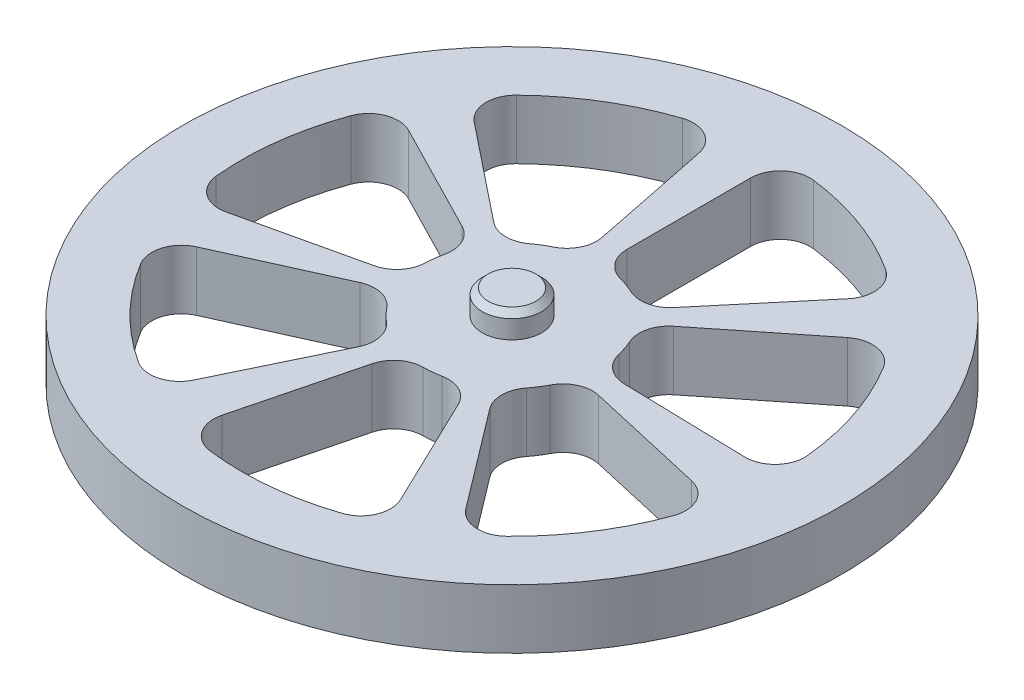
from build123d import *

# Parameters (mm, degrees)
SKETCH1_R                = 55.5
BOSS_EXTRUDE1_DEPTH      = 10
CUT_EXTRUDE1_DEPTH       = 80.123321467
FILLET1_R                = 5
CIRPATTERN1_COUNT        = 7
FILLET1_OF_CIRPATTERN1_R = 5
SKETCH3_R                = 5
BOSS_EXTRUDE2_DEPTH      = 4.1
CHAMFER1_SIZE            = 1


with BuildPart() as part:
    # Sketch1 → Boss-Extrude1 (new body)
    with BuildSketch(Plane(origin=(0, 0, 0), x_dir=(1, 0, 0), z_dir=(0, 1, 0))):
        with Locations(Location((0, 0, 0), (0, 0, 270))):
            Circle(SKETCH1_R)
    extrude(amount=BOSS_EXTRUDE1_DEPTH)

    # Sketch2 → Cut-Extrude1 (cut, through all)
    with BuildSketch(Plane(origin=(0, 10, 0), x_dir=(1, 0, 0), z_dir=(0, 1, 0))):
        with BuildLine():
            Line((0, 15), (0, 45.5))
            ThreePointArc((0, 45.5), (15.561916521, 42.756014246), (29.246836241, 34.855022162))
            Line((29.246836241, 34.855022162), (9.641814145, 11.490666647))
            ThreePointArc((9.641814145, 11.490666647), (5.13030215, 14.095389312), (0, 15))
        make_face()
    cut_extrude1 = extrude(amount=-CUT_EXTRUDE1_DEPTH, mode=Mode.SUBTRACT)

    # Fillet1
    fillet1_edges = [part.edges().sort_by_distance(p)[0] for p in [
        (9.641814145, 5, -11.490666647),
        (0, 5, -15),
        (0, 5, -45.5),
        (29.246836241, 5, -34.855022162),
    ]]
    fillet(fillet1_edges, radius=FILLET1_R)

    # CirPattern1: Cut-Extrude1 ×7 about axis
    cirpattern1_axis = Axis((0, 0, 0), (0, 1, 0))
    for i in range(1, CIRPATTERN1_COUNT):
        add(cut_extrude1.rotate(cirpattern1_axis, i * 360 / CIRPATTERN1_COUNT), mode=Mode.SUBTRACT)

    # Fillet1 of CirPattern1
    fillet1_of_cirpattern1_edges = [part.edges().sort_by_distance(p)[0] for p in [
        (-2.972192148, 5, -14.702587318),
        (-11.727472237, 5, -9.352347028),
        (-35.573332452, 5, -28.368785985),
        (-9.015649516, 5, -44.597848197),
        (-13.348077132, 5, -6.84315986),
        (-14.623918683, 5, 3.337814009),
        (-44.359220004, 5, 10.124702495),
        (-40.489167301, 5, -20.75758491),
        (-13.672587785, 5, 6.169306547),
        (-6.508256087, 5, 13.514533019),
        (-19.74171013, 5, 40.99408349),
        (-41.47351628, 5, 18.713563192),
        (-3.701360965, 5, 14.536159293),
        (6.508256087, 5, 13.514533019),
        (19.74171013, 5, 40.99408349),
        (-11.227461595, 5, 44.093016523),
        (9.057066155, 5, 11.956987608),
        (14.623918683, 5, 3.337814009),
        (44.359220004, 5, 10.124702495),
        (27.47310067, 5, 36.269529079),
        (14.99533773, 5, 0.373960376),
        (11.727472237, 5, -9.352347028),
        (35.573332452, 5, -28.368785985),
        (45.485857781, 5, 1.134346474),
    ]]
    fillet(fillet1_of_cirpattern1_edges, radius=FILLET1_OF_CIRPATTERN1_R)

    # Sketch3 → Boss-Extrude2 (add)
    with BuildSketch(Plane(origin=(0, 10, 0), x_dir=(1, 0, 0), z_dir=(0, 1, 0))):
        with Locations(Location((0, 0, 0), (0, 0, 270))):
            Circle(SKETCH3_R)
    extrude(amount=BOSS_EXTRUDE2_DEPTH)

    # Chamfer1
    chamfer1_edges = [part.edges().sort_by_distance(p)[0] for p in [
        (0, 14.1, -5),
    ]]
    chamfer(chamfer1_edges, length=CHAMFER1_SIZE)


solid = part.part
